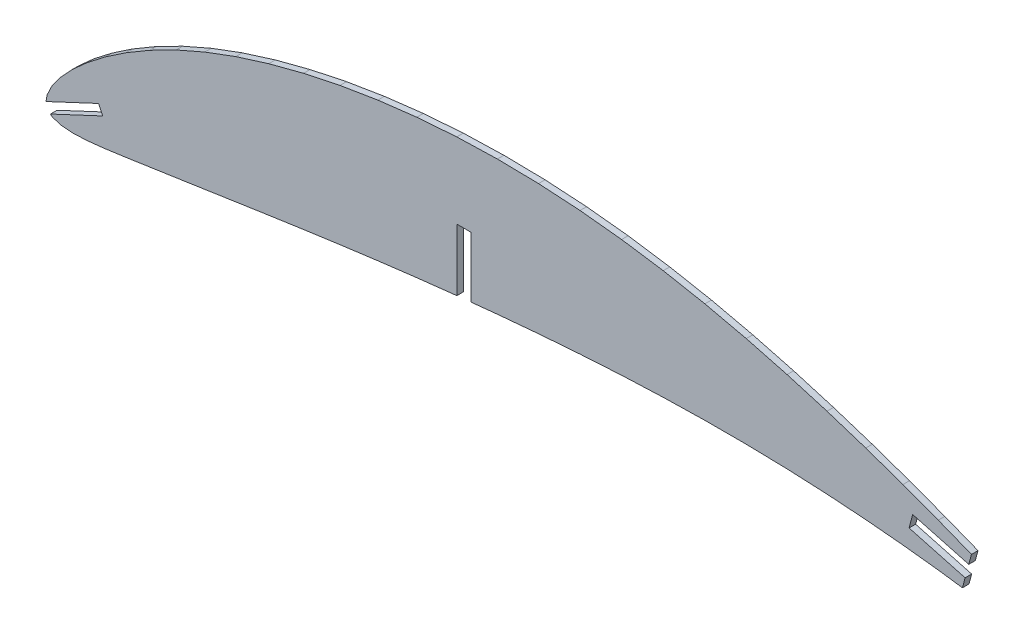
from build123d import *

# Parameters (mm, degrees)
BOSS_EXTRUDE1_DEPTH = 2


with BuildPart() as part:
    # Sketch3 → Boss-Extrude1 (new body)
    with BuildSketch(Plane.XY):
        Polygon((-14.937058558, 2.21001318), (-15.262222558, 0.31211718), (0.837047412, 7.846314644), (2.092746989, 5.163102983), (-13.883666124, -2.313599464), (-13.443958558, -2.76698682), (-10.822738558, -3.64625682), (-7.189528558, -3.94487682), (-2.617324558, -3.74579682), (2.880601442, -3.14523882), (9.274387442, -2.25269682), (16.510945442, -1.17766482), (24.550459442, 0.01349718), (33.339841442, 1.32742518), (42.816049442, 2.74752918), (52.919359442, 4.25058318), (63.573457442, 5.79677118), (74.721937442, 7.35291318), (86.298439442, 8.88251118), (98.226649442, 10.35238518), (98.27276469, 10.35238518), (110.49295869, 11.73599118), (110.49295869, 30.69599118), (114.75895869, 30.69599118), (114.75895869, 12.175134882), (122.892661442, 13.00346718), (135.491107442, 14.12826918), (148.199047442, 15.08385318), (160.920259442, 15.83703918), (173.654743442, 16.36128318), (186.399181442, 16.63335918), (199.060669442, 16.63004118), (211.552939442, 16.34137518), (223.776451442, 15.76736118), (235.631665442, 14.94117918), (247.019041442, 13.89600918), (257.839039442, 12.67166718), (265.230573217, 11.664718606), (266.057040727, 14.725920032), (248.896458551, 19.358958388), (250.008387757, 23.47749811), (267.168969932, 18.844459754), (267.995437442, 21.90566118), (257.839039442, 25.89721518), (247.019041442, 29.93522118), (235.631665442, 33.92013918), (223.776451442, 37.75242918), (211.552939442, 41.35577718), (199.060669442, 44.64059718), (186.399181442, 47.52393918), (173.654743442, 49.93612518), (160.920259442, 51.82074918), (148.199047442, 53.16122118), (135.491107442, 53.93763318), (122.892661442, 54.14998518), (110.446843442, 53.79495918), (98.226649442, 52.89578118), (86.298439442, 51.47567718), (74.721937442, 49.56782718), (63.573457442, 47.20872918), (52.919359442, 44.42824518), (42.816049442, 41.25955518), (33.339841442, 37.72920318), (24.550459442, 33.88364118), (16.510945442, 29.78259318), (9.274387442, 25.51896318), (2.880601442, 21.20888118), (-2.617324558, 16.96184118), (-7.189528558, 12.85083918), (-10.822738558, 8.94223518), (-13.443958558, 5.34552318), align=None)
    extrude(amount=BOSS_EXTRUDE1_DEPTH)


solid = part.part
